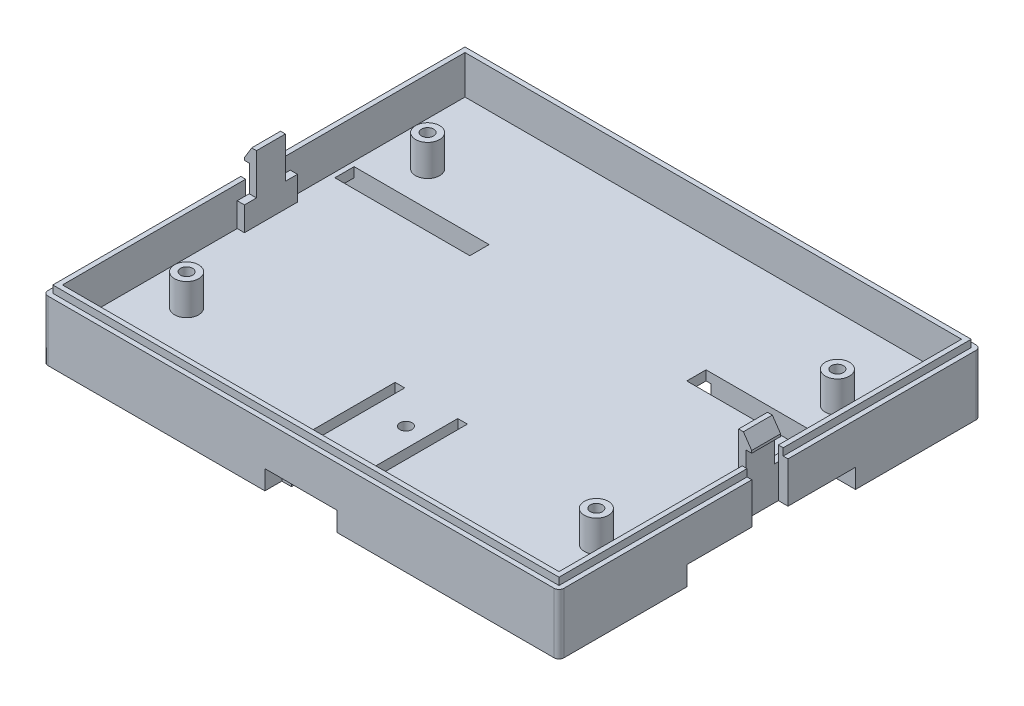
from build123d import *

# Parameters (mm, degrees)
BOSS_EXTRUDE1_DEPTH  = 12.5
SKETCH2_W            = 103
SKETCH2_H            = 83.5
CUT_EXTRUDE1_DEPTH   = 4
SKETCH3_W            = 103
SKETCH3_H            = 83.5
CUT_EXTRUDE2_DEPTH   = 6.5
SKETCH4_W            = 105
SKETCH4_H            = 85.5
SKETCH4_W_2          = 103
SKETCH4_H_2          = 83.5
BOSS_EXTRUDE2_DEPTH  = 1.5
SKETCH7_W            = 35
SKETCH7_H            = 4
CUT_EXTRUDE3_DEPTH   = 117.443387532
SKETCH8_W            = 7.5
SKETCH8_H            = 10
CUT_EXTRUDE4_DEPTH   = 2
SKETCH9_W            = 7.5
SKETCH9_H            = 10
CUT_EXTRUDE5_DEPTH   = 2
BOSS_EXTRUDE3_DEPTH  = 1.5
BOSS_EXTRUDE4_DEPTH  = 1.5
BOSS_EXTRUDE5_DEPTH  = 6
BOSS_EXTRUDE6_DEPTH  = 6
SKETCH14_W           = 28
SKETCH14_H           = 4
CUT_EXTRUDE6_DEPTH   = 2
SKETCH15_W           = 15
SKETCH15_H           = 3.5
CUT_EXTRUDE7_DEPTH   = 4
SKETCH16_R           = 1.25
SKETCH16_W           = 2
SKETCH16_H           = 24
CUT_EXTRUDE8_DEPTH   = 2
SKETCH17_R           = 2.5
SKETCH17_R_2         = 1.25
BOSS_EXTRUDE7_DEPTH  = 6.5
SKETCH18_W           = 28
SKETCH18_H           = 2
BOSS_EXTRUDE8_DEPTH  = 4
BOSS_EXTRUDE9_DEPTH  = 26
BOSS_EXTRUDE10_DEPTH = 26
BOSS_EXTRUDE11_DEPTH = 4
SKETCH22_W           = 22.25
SKETCH22_H           = 2
BOSS_EXTRUDE12_DEPTH = 2
SKETCH23_W           = 22.25
SKETCH23_H           = 2
BOSS_EXTRUDE13_DEPTH = 2


with BuildPart() as part:
    # Sketch1 → Boss-Extrude1 (new body)
    with BuildSketch(Plane(origin=(0, 0, 0), x_dir=(1, 0, 0), z_dir=(0, 1, 0))):
        with BuildLine():
            Line((52.5, -43.75), (-52.5, -43.75))
            ThreePointArc((-52.5, -43.75), (-53.207106781, -43.457106781), (-53.5, -42.75))
            Line((-53.5, -42.75), (-53.5, 42.75))
            ThreePointArc((-53.5, 42.75), (-53.207106781, 43.457106781), (-52.5, 43.75))
            Line((-52.5, 43.75), (52.5, 43.75))
            ThreePointArc((52.5, 43.75), (53.207106781, 43.457106781), (53.5, 42.75))
            Line((53.5, 42.75), (53.5, -42.75))
            ThreePointArc((53.5, -42.75), (53.207106781, -43.457106781), (52.5, -43.75))
        make_face()
    extrude(amount=BOSS_EXTRUDE1_DEPTH)

    # Sketch2 → Cut-Extrude1 (cut)
    with BuildSketch(Plane.XZ):
        Rectangle(SKETCH2_W, SKETCH2_H)
    extrude(amount=-CUT_EXTRUDE1_DEPTH, mode=Mode.SUBTRACT)

    # Sketch3 → Cut-Extrude2 (cut)
    with BuildSketch(Plane(origin=(0, 12.5, 0), x_dir=(1, 0, 0), z_dir=(0, 1, 0))):
        Rectangle(SKETCH3_W, SKETCH3_H)
    extrude(amount=-CUT_EXTRUDE2_DEPTH, mode=Mode.SUBTRACT)

    # Sketch4 → Boss-Extrude2 (add)
    with BuildSketch(Plane(origin=(0, 12.5, 0), x_dir=(1, 0, 0), z_dir=(0, 1, 0))):
        Rectangle(SKETCH4_W, SKETCH4_H)
        Rectangle(SKETCH4_W_2, SKETCH4_H_2, mode=Mode.SUBTRACT)
    extrude(amount=BOSS_EXTRUDE2_DEPTH)

    # Sketch7 → Cut-Extrude3 (cut, through all)
    with BuildSketch(Plane.ZY.offset(53.5)):
        with Locations((-0.25, 2)):
            Rectangle(SKETCH7_W, SKETCH7_H)
    extrude(amount=-CUT_EXTRUDE3_DEPTH, mode=Mode.SUBTRACT)

    # Sketch8 → Cut-Extrude4 (cut)
    with BuildSketch(Plane.ZY.offset(53.5)):
        with Locations((0, 9)):
            Rectangle(SKETCH8_W, SKETCH8_H)
    extrude(amount=-CUT_EXTRUDE4_DEPTH, mode=Mode.SUBTRACT)

    # Sketch9 → Cut-Extrude5 (cut)
    with BuildSketch(Plane(origin=(53.5, 0, 0), x_dir=(0, 0, -1), z_dir=(1, 0, 0))):
        with Locations((0, 9)):
            Rectangle(SKETCH9_W, SKETCH9_H)
    extrude(amount=-CUT_EXTRUDE5_DEPTH, mode=Mode.SUBTRACT)

    # Sketch10 → Boss-Extrude3 (add)
    with BuildSketch(Plane.ZY.offset(-51.5)):
        Polygon((5.5, 6), (-5.5, 6), (-5.5, 11), (-3, 11), (-3, 16.5), (3, 16.5), (3, 11), (5.5, 11), align=None)
    extrude(amount=BOSS_EXTRUDE3_DEPTH)

    # Sketch11 → Boss-Extrude4 (add)
    with BuildSketch(Plane(origin=(-51.5, 0, 0), x_dir=(0, 0, -1), z_dir=(1, 0, 0))):
        Polygon((-5.5, 11), (-5.5, 6), (5.5, 6), (5.5, 11), (3, 11), (3, 16.5), (-3, 16.5), (-3, 11), align=None)
    extrude(amount=BOSS_EXTRUDE4_DEPTH)

    # Sketch12 → Boss-Extrude5 (add)
    with BuildSketch(Plane(origin=(0, 0, -3), x_dir=(-1, 0, 0), z_dir=(0, 0, -1))):
        Polygon((-52.720588235, 16.5), (-50, 16.5), (-50, 19.5), (-51, 19.5), (-52.720588235, 17), align=None)
    extrude(amount=-BOSS_EXTRUDE5_DEPTH)

    # Sketch13 → Boss-Extrude6 (add)
    with BuildSketch(Plane(origin=(0, 0, -3), x_dir=(-1, 0, 0), z_dir=(0, 0, -1))):
        Polygon((50, 16.5), (52.5, 16.5), (52.5, 17), (51, 19.5), (50, 19.5), align=None)
    extrude(amount=-BOSS_EXTRUDE6_DEPTH)

    # Sketch14 → Cut-Extrude6 (cut)
    with BuildSketch(Plane.XZ.offset(-4)):
        with Locations((36.5, -15.75)):
            Rectangle(SKETCH14_W, SKETCH14_H)
        with Locations((-36.5, -15.75)):
            Rectangle(SKETCH14_W, SKETCH14_H)
    extrude(amount=-CUT_EXTRUDE6_DEPTH, mode=Mode.SUBTRACT)

    # Sketch15 → Cut-Extrude7 (cut)
    with BuildSketch(Plane.XZ):
        with Locations((0, 42)):
            Rectangle(SKETCH15_W, SKETCH15_H)
    extrude(amount=-CUT_EXTRUDE7_DEPTH, mode=Mode.SUBTRACT)

    # Sketch16 → Cut-Extrude8 (cut)
    with BuildSketch(Plane(origin=(0, 6, 0), x_dir=(1, 0, 0), z_dir=(0, 1, 0))):
        with Locations(Location((1.5, -23.5, 0), (0, 0, 270))):
            Circle(SKETCH16_R)
        with Locations((6.5, -28.75)):
            Rectangle(SKETCH16_W, SKETCH16_H)
        with Locations((-6.5, -28.75)):
            Rectangle(SKETCH16_W, SKETCH16_H)
    extrude(amount=-CUT_EXTRUDE8_DEPTH, mode=Mode.SUBTRACT)

    # Sketch17 → Boss-Extrude7 (add)
    # profile 1 of 4: a face of its own
    with BuildSketch(Plane(origin=(0, 6, 0), x_dir=(1, 0, 0), z_dir=(0, 1, 0))):
        with Locations(Location((42.5, 25, 0), (0, 0, 90))):
            Circle(SKETCH17_R)
        with Locations(Location((42.5, 25, 0), (0, 0, 90))):
            Circle(SKETCH17_R_2, mode=Mode.SUBTRACT)
    # profile 2 of 4: a face of its own
    with BuildSketch(Plane(origin=(0, 6, 0), x_dir=(1, 0, 0), z_dir=(0, 1, 0))):
        with Locations(Location((42.5, -25, 0), (0, 0, 90))):
            Circle(SKETCH17_R)
        with Locations(Location((42.5, -25, 0), (0, 0, 90))):
            Circle(SKETCH17_R_2, mode=Mode.SUBTRACT)
    # profile 3 of 4: a face of its own
    with BuildSketch(Plane(origin=(0, 6, 0), x_dir=(1, 0, 0), z_dir=(0, 1, 0))):
        with Locations(Location((-42.5, 25, 0), (0, 0, 90))):
            Circle(SKETCH17_R)
        with Locations(Location((-42.5, 25, 0), (0, 0, 90))):
            Circle(SKETCH17_R_2, mode=Mode.SUBTRACT)
    # profile 4 of 4: a face of its own
    with BuildSketch(Plane(origin=(0, 6, 0), x_dir=(1, 0, 0), z_dir=(0, 1, 0))):
        with Locations(Location((-42.5, -25, 0), (0, 0, 90))):
            Circle(SKETCH17_R)
        with Locations(Location((-42.5, -25, 0), (0, 0, 90))):
            Circle(SKETCH17_R_2, mode=Mode.SUBTRACT)
    extrude(amount=BOSS_EXTRUDE7_DEPTH)

    # Sketch18 → Boss-Extrude8 (add)
    with BuildSketch(Plane.XZ.offset(-4)):
        with Locations((-37.5, -18.75)):
            Rectangle(SKETCH18_W, SKETCH18_H)
        with Locations((37.5, -18.75)):
            Rectangle(SKETCH18_W, SKETCH18_H)
    extrude(amount=BOSS_EXTRUDE8_DEPTH)

    # Sketch19 → Boss-Extrude9 (add)
    with BuildSketch(Plane.ZY.offset(-23.5)):
        Polygon((-17.75, 0), (-14.75, 0), (-14.75, 1), (-15.75, 2), (-17.75, 2), align=None)
    extrude(amount=-BOSS_EXTRUDE9_DEPTH)

    # Sketch20 → Boss-Extrude10 (add)
    with BuildSketch(Plane(origin=(-23.5, 0, 0), x_dir=(0, 0, -1), z_dir=(1, 0, 0))):
        Polygon((14.75, 0), (17.75, 0), (17.75, 2), (15.75, 2), (14.75, 1), align=None)
    extrude(amount=-BOSS_EXTRUDE10_DEPTH)

    # Sketch21 → Boss-Extrude11 (add)
    with BuildSketch(Plane.XZ.offset(-4)):
        Polygon((7.5, 41.75), (7.5, 17.75), (40.5, 17.75), (43.496447897, 19.48), (42.497454433, 21.215), (39.96, 19.75), (9.5, 19.75), (9.5, 41.75), align=None)
        Polygon((-7.5, 41.75), (-7.5, 17.75), (-40.5, 17.75), (-43.496447897, 19.48), (-42.497454433, 21.215), (-39.96, 19.75), (-9.5, 19.75), (-9.5, 41.75), align=None)
    extrude(amount=BOSS_EXTRUDE11_DEPTH)

    # Sketch22 → Boss-Extrude12 (add)
    with BuildSketch(Plane.ZY.offset(-7.5)):
        with Locations((29.125, 1)):
            Rectangle(SKETCH22_W, SKETCH22_H)
    extrude(amount=BOSS_EXTRUDE12_DEPTH)

    # Sketch23 → Boss-Extrude13 (add)
    with BuildSketch(Plane(origin=(-7.5, 0, 0), x_dir=(0, 0, -1), z_dir=(1, 0, 0))):
        with Locations((-29.125, 1)):
            Rectangle(SKETCH23_W, SKETCH23_H)
    extrude(amount=BOSS_EXTRUDE13_DEPTH)


solid = part.part
